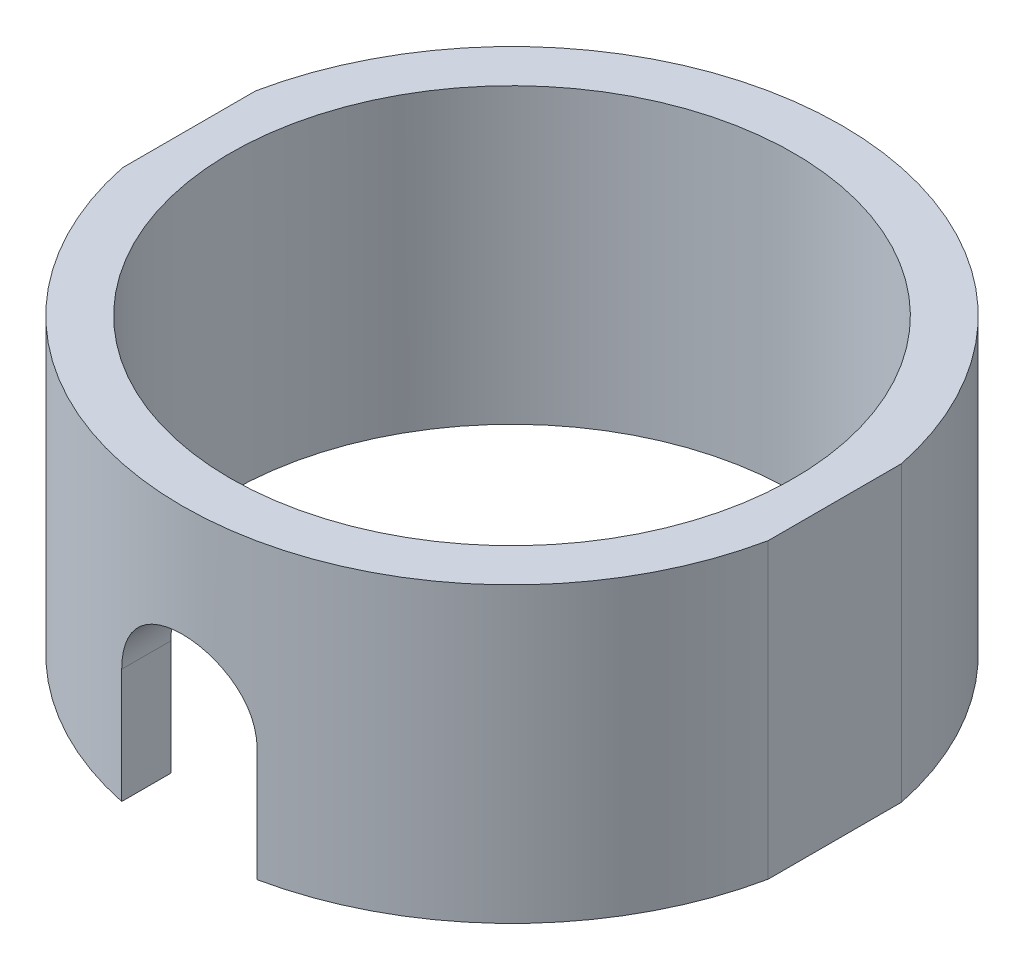
from build123d import *

# Parameters (mm, degrees)
BOSS_EXTRUDE1_DEPTH      = 54
BOSS_EXTRUDE1_DEPTH_BACK = 1
SKETCH1_R                = 52.838
CUT_EXTRUDE1_DEPTH       = 53


with BuildPart() as part:
    # Sketch1 → Boss-Extrude1 (new, two sides: drawn at the far end of the back side and taken through both)
    with BuildSketch(Plane(origin=(0, 0, 0), x_dir=(1, 0, 0), z_dir=(0, 1, 0)).offset(-BOSS_EXTRUDE1_DEPTH_BACK)):
        with BuildLine():
            Line((-51.240048916, 38.94945257), (-51.240048916, 13.94945257))
            ThreePointArc((-51.240048916, 13.94945257), (9.321392976, -35.38854743), (69.882834868, 13.94945257))
            Line((69.882834868, 13.94945257), (69.882834868, 38.94945257))
            ThreePointArc((69.882834868, 38.94945257), (9.321392976, 88.28745257), (-51.240048916, 38.94945257))
        make_face()
        with Locations(Location((9.321392976, 26.44945257, 0), (0, 0, 270))):
            Circle(SKETCH1_R, mode=Mode.SUBTRACT)
    extrude(amount=BOSS_EXTRUDE1_DEPTH + BOSS_EXTRUDE1_DEPTH_BACK)

    # Sketch2 → Cut-Extrude1 (cut)
    with BuildSketch(Plane.XY):
        with BuildLine():
            Line((-3.360607024, 20.5), (-3.360607024, -1))
            Line((-3.360607024, -1), (22.003392976, -1))
            Line((22.003392976, -1), (22.003392976, 20.5))
            ThreePointArc((22.003392976, 20.5), (9.321392976, 33.182), (-3.360607024, 20.5))
        make_face()
    extrude(amount=CUT_EXTRUDE1_DEPTH, mode=Mode.SUBTRACT)


solid = part.part
